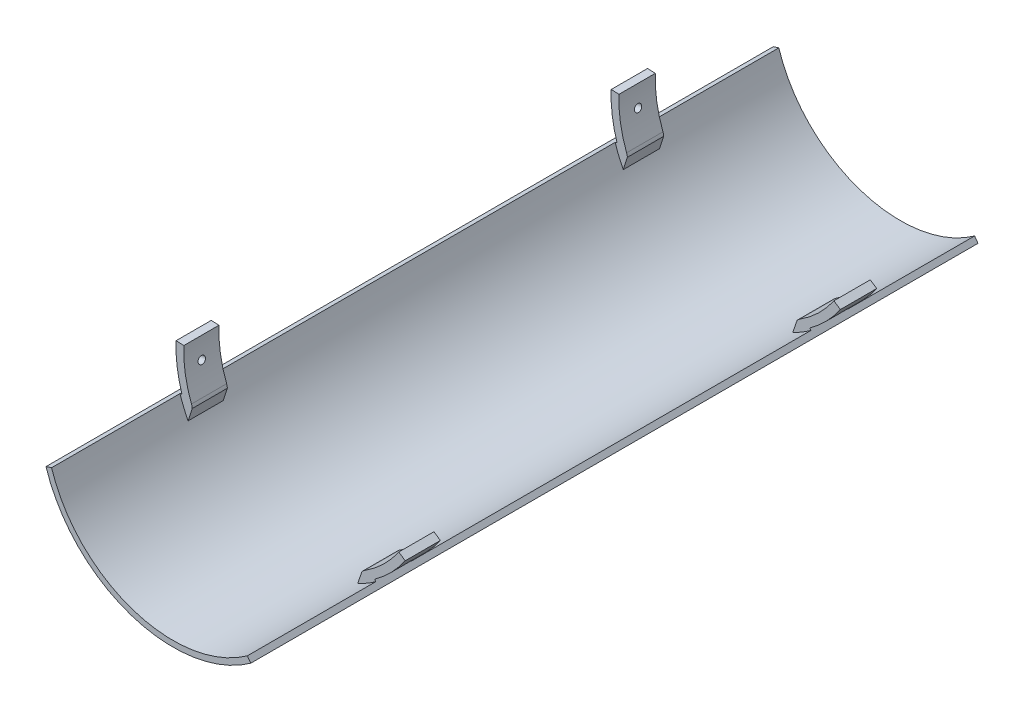
from build123d import *

# Parameters (mm, degrees)
EXTRUDE_1_DEPTH     = 150
EXTRUDE_START       = -247.5
EXTRUDE_2_DEPTH     = 247.5
SKETCH_3_R          = 52.6
CUT_EXTRUDE_1_DEPTH = 52.5
SKETCH_4_R          = 52.6
CUT_EXTRUDE_2_DEPTH = 82.5
SKETCH_6_R          = 1.5
CUT_EXTRUDE_3_DEPTH = 165
SKETCH_7_R          = 1.5
CUT_EXTRUDE_4_DEPTH = 165
CUT_EXTRUDE_5_DEPTH = 500
CUT_EXTRUDE_START   = -53
SKETCH_9_R          = 52.6
CUT_EXTRUDE_6_DEPTH = 53


with BuildPart() as part:
    # 草图1 → 凸台-拉伸1 (new, symmetric)
    with BuildSketch(Plane.XY):
        with BuildLine():
            Line((-52.413174316, -16.669107897), (-49.363680538, -15.699268892))
            ThreePointArc((-49.363680538, -15.699268892), (-16.314268086, -49.163855187), (30.185108172, -42.096309157))
            Line((30.185108172, -42.096309157), (32.049825279, -44.696853352))
            ThreePointArc((32.049825279, -44.696853352), (-17.322099319, -52.201004542), (-52.413174316, -16.669107897))
        make_face()
    extrude(amount=EXTRUDE_1_DEPTH, both=True)

    # 草图2 → 凸台-拉伸2 (add)
    with BuildSketch(Plane(origin=(0, 0, -150), x_dir=(-1, 0, 0), z_dir=(0, 0, -1)).offset(EXTRUDE_START)):
        with BuildLine():
            Line((-24.924043095, -42.002946324), (-23.507517235, -46.158819671))
            ThreePointArc((-23.507517235, -46.158819671), (-34.198599667, -38.906243468), (-42.762509098, -29.233676054))
            Line((-42.762509098, -29.233676054), (-40.120809695, -27.427734676))
            ThreePointArc((-40.120809695, -27.427734676), (-33.774000748, -34.946772003), (-26.042778843, -41.033323898))
            ThreePointArc((-26.042778843, -41.033323898), (-25.447325167, -41.476499857), (-24.924043095, -42.002946324))
        make_face()
        with BuildLine():
            Line((48.558861257, 1.99924822), (51.756152533, 2.130885963))
            ThreePointArc((51.756152533, 2.130885963), (50.673816706, -10.742639362), (46.439539695, -22.947966205))
            Line((46.439539695, -22.947966205), (45.090508335, -18.769695848))
            ThreePointArc((45.090508335, -18.769695848), (45.195249795, -18.034849445), (45.40762753, -17.323607076))
            ThreePointArc((45.40762753, -17.323607076), (47.966326083, -7.822503569), (48.558861257, 1.99924822))
        make_face()
    extrude(amount=EXTRUDE_2_DEPTH)

    # 草图3 → 切除-拉伸1 (cut)
    with BuildSketch(Plane(origin=(0, 0, -150), x_dir=(-1, 0, 0), z_dir=(0, 0, -1))):
        Circle(SKETCH_3_R)
    extrude(amount=-CUT_EXTRUDE_1_DEPTH, mode=Mode.SUBTRACT)

    # 草图4 → 切除-拉伸2 (cut, symmetric)
    with BuildSketch(Plane.XY):
        Circle(SKETCH_4_R)
    extrude(amount=CUT_EXTRUDE_2_DEPTH, both=True, mode=Mode.SUBTRACT)

    # 草图6 → 切除-拉伸3 (cut)
    with BuildSketch(Plane(origin=(0, 0, 0), x_dir=(-0.6991347993064156, -0.7149898827247683, 0), z_dir=(0.7149898827247683, -0.6991347993064156, 0))):
        with Locations((0, 90)):
            Circle(SKETCH_6_R)
        with Locations((0, -90)):
            Circle(SKETCH_6_R)
    extrude(amount=CUT_EXTRUDE_3_DEPTH, mode=Mode.SUBTRACT)

    # 草图7 → 切除-拉伸4 (cut)
    with BuildSketch(Plane(origin=(0, 0, 0), x_dir=(0.13298935431462466, -0.991117466115384, 0), z_dir=(0.991117466115384, 0.13298935431462466, 0))):
        with Locations(Location((0, 90, 0), (0, 0, 180))):
            Circle(SKETCH_7_R)
        with Locations(Location((0, -90, 0), (0, 0, 180))):
            Circle(SKETCH_7_R)
    extrude(amount=-CUT_EXTRUDE_4_DEPTH, mode=Mode.SUBTRACT)

    # 草图8 → 切除-拉伸5 (cut)
    with BuildSketch(Plane(origin=(0, 0, -150), x_dir=(-1, 0, 0), z_dir=(0, 0, -1))):
        with BuildLine():
            Line((-24.924043095, -42.002946324), (-23.132074518, -47.240524219))
            ThreePointArc((-23.132074518, -47.240524219), (16.570504001, -49.921722698), (46.789382897, -24.031513647))
            Line((46.789382897, -24.031513647), (45.090508335, -18.769695848))
            Line((45.090508335, -18.769695848), (-24.924043095, -42.002946324))
        make_face()
    extrude(amount=-CUT_EXTRUDE_5_DEPTH, mode=Mode.SUBTRACT)

    # 草图9 → 切除-拉伸6 (cut)
    with BuildSketch(Plane.XY.offset(150).offset(CUT_EXTRUDE_START)):
        Circle(SKETCH_9_R)
    extrude(amount=CUT_EXTRUDE_6_DEPTH, mode=Mode.SUBTRACT)


solid = part.part
